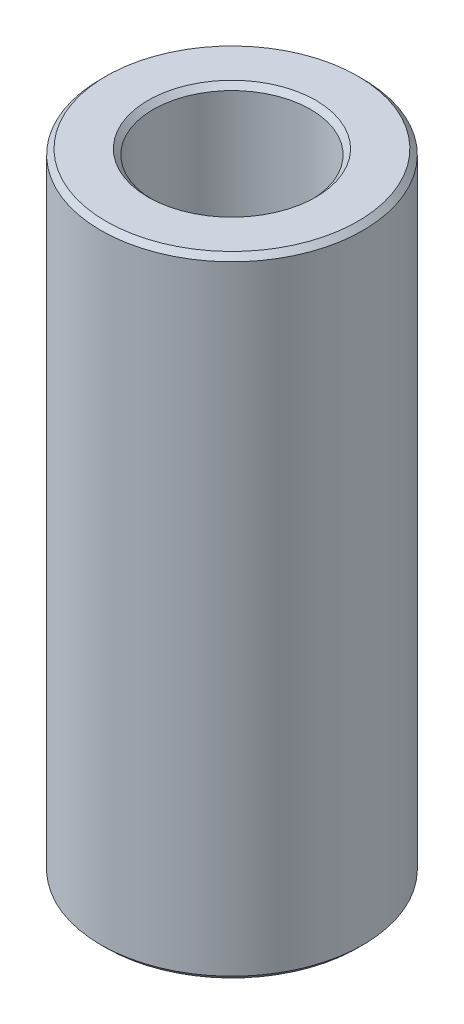
from build123d import *

# Parameters (mm, degrees)
SKETCH1_R           = 2.5
SKETCH1_R_2         = 1.5
BOSS_EXTRUDE1_DEPTH = 12
CHAMFER1_SIZE       = 0.1


with BuildPart() as part:
    # Sketch1 → Boss-Extrude1 (new body)
    with BuildSketch(Plane(origin=(0, 0, 0), x_dir=(1, 0, 0), z_dir=(0, 1, 0))):
        with Locations(Location((0, 0, 0), (0, 0, 270))):
            Circle(SKETCH1_R)
        with Locations(Location((0, 0, 0), (0, 0, 270))):
            Circle(SKETCH1_R_2, mode=Mode.SUBTRACT)
    extrude(amount=BOSS_EXTRUDE1_DEPTH)

    # Chamfer1
    chamfer1_edges = [part.edges().sort_by_distance(p)[0] for p in [
        (0, 0, -2.5),
        (0, 12, -2.5),
        (0, 0, -1.5),
        (0, 12, -1.5),
    ]]
    chamfer(chamfer1_edges, length=CHAMFER1_SIZE)


solid = part.part
